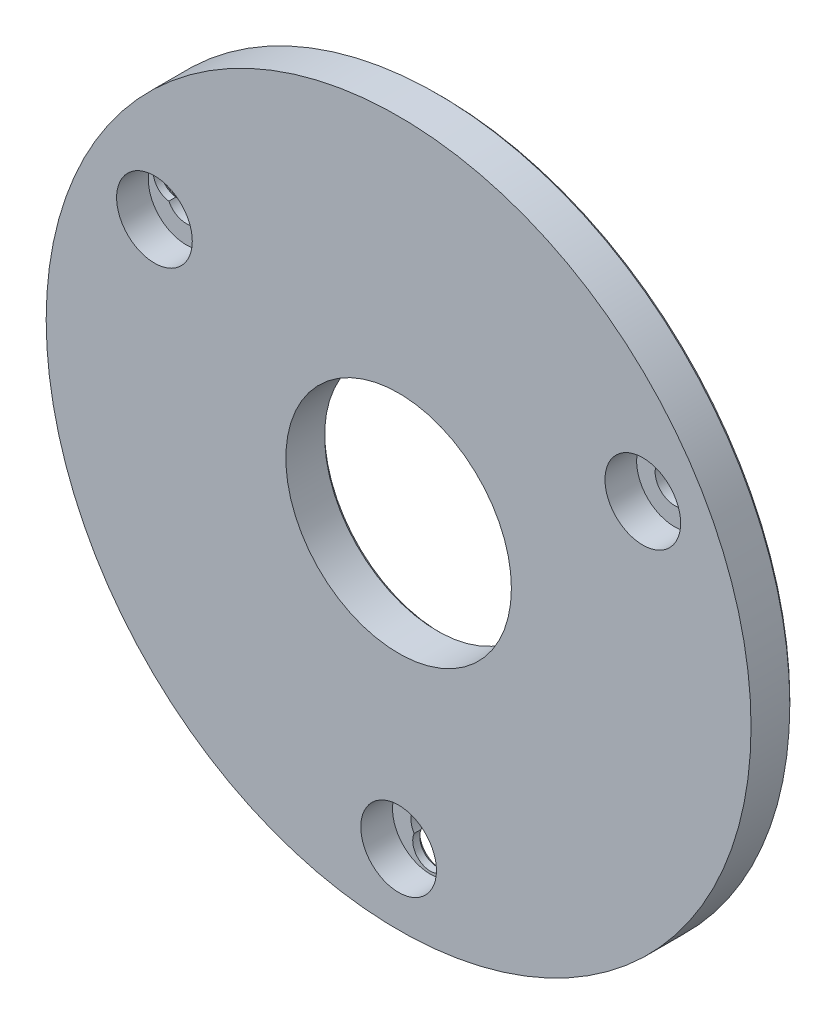
from build123d import *

# Parameters (mm, degrees)
SCHIZZO1_R                                           = 100
SCHIZZO1_R_2                                         = 32
SCHIZZO1_R_3                                         = 5
ESTRUSIONE1_DEPTH                                    = 12
SMUSSO1_SIZE                                         = 1
M10_FORO_LAMATO_PER_VITE_A_TESTA_ESAGONA_D           = 11
M10_FORO_LAMATO_PER_VITE_A_TESTA_ESAGONA_CBORE_D     = 21.475
M10_FORO_LAMATO_PER_VITE_A_TESTA_ESAGONA_CBORE_DEPTH = 9


with BuildPart() as part:
    # Schizzo1 → Estrusione1 (new body)
    with BuildSketch(Plane.XY):
        Circle(SCHIZZO1_R)
        Circle(SCHIZZO1_R_2, mode=Mode.SUBTRACT)
        with Locations((-73.612159322, 42.5)):
            Circle(SCHIZZO1_R_3, mode=Mode.SUBTRACT)
        with Locations((73.612159322, 42.5)):
            Circle(SCHIZZO1_R_3, mode=Mode.SUBTRACT)
        with Locations((0, -85)):
            Circle(SCHIZZO1_R_3, mode=Mode.SUBTRACT)
    extrude(amount=ESTRUSIONE1_DEPTH)

    # Smusso1
    smusso1_edges = [part.edges().sort_by_distance(p)[0] for p in [
        (68.612159322, 42.5, 0),
        (-5, -85, 0),
        (-100, 0, 0),
        (-32, 0, 0),
        (-78.612159322, 42.5, 0),
    ]]
    chamfer(smusso1_edges, length=SMUSSO1_SIZE)

    # M10 Foro lamato per vite a testa esagonale (parzialmente filettata)2 (through all)
    with Locations(Plane(origin=(-8.776237921, -26.129151675, 12), x_dir=(0.9999999999963068, -2.7178071316053742e-06, 0), z_dir=(0, 0, 1))):
        with Locations((-60.505865396, 66.129175527), (8.776166907, -53.870824473), (78.05819921, 66.129175527)):
            CounterBoreHole(M10_FORO_LAMATO_PER_VITE_A_TESTA_ESAGONA_D / 2, M10_FORO_LAMATO_PER_VITE_A_TESTA_ESAGONA_CBORE_D / 2, M10_FORO_LAMATO_PER_VITE_A_TESTA_ESAGONA_CBORE_DEPTH)


solid = part.part
